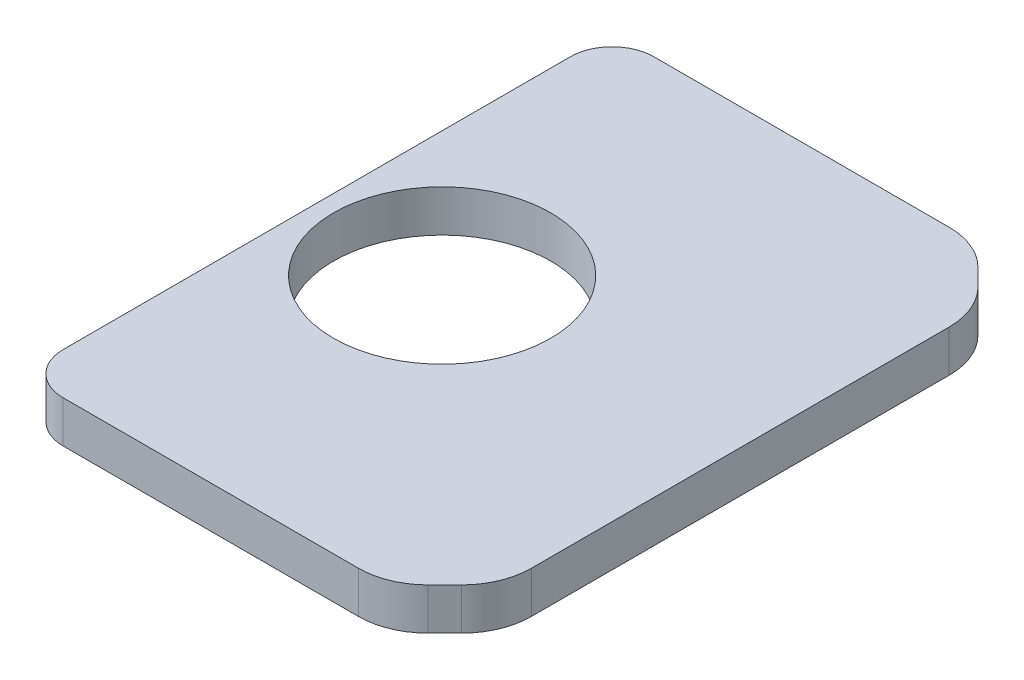
from build123d import *

# Parameters (mm, degrees)
SZKIC1_R                        = 1.65
SZKIC1_R_2                      = 7.798887489
DODANIE_WYCI_GNI_CIE1_DEPTH     = 3
ZAOKR_GLENIE1_R                 = 5
WYTNIJ_WYCI_GNI_CIE1_DEPTH      = 72.750306382
WYTNIJ_WYCI_GNI_CIE1_DEPTH_BACK = 72.750306382
SZKIC2_W                        = 22.67550991
SZKIC2_H                        = 46.936854919
ZAOKR_GLENIE5_R                 = 3
SZKIC3_R                        = 1.65
WYTNIJ_WYCI_GNI_CIE2_DEPTH      = 62.58622378
DODANIE_WYCI_GNI_CIE2_START     = -0.2
SZKIC4_R                        = 1.65
DODANIE_WYCI_GNI_CIE2_DEPTH     = 0.2


with BuildPart() as part:
    # Szkic1 → Dodanie-wyciągnięcie1 (new body)
    with BuildSketch(Plane(origin=(0, 0, 0), x_dir=(1, 0, 0), z_dir=(0, 1, 0))):
        with BuildLine():
            ThreePointArc((-57.522805166, 36.596117071), (-60.573917858, 31.893472489), (-61.642766658, 26.390589884))
            Line((-61.642766658, 26.390589884), (-61.642766658, 4.401644259))
            ThreePointArc((-61.642766658, 4.401644259), (-60.573917858, -1.101238346), (-57.522805166, -5.803882929))
            Line((-57.522805166, -5.803882929), (-23.176157761, -5.803882929))
            Line((-23.176157761, -5.803882929), (-19.042766658, -1.670491825))
            Line((-19.042766658, -1.670491825), (-19.042766658, 32.462725968))
            Line((-19.042766658, 32.462725968), (-23.176157761, 36.596117071))
            Line((-23.176157761, 36.596117071), (-57.522805166, 36.596117071))
        make_face()
        with Locations(Location((-55.942766658, -0.103882929, 0), (0, 0, 270))):
            Circle(SZKIC1_R, mode=Mode.SUBTRACT)
        with Locations(Location((-24.942766658, -0.103882929, 0), (0, 0, 270))):
            Circle(SZKIC1_R, mode=Mode.SUBTRACT)
        with Locations(Location((-55.942766658, 30.896117071, 0), (0, 0, 270))):
            Circle(SZKIC1_R, mode=Mode.SUBTRACT)
        with Locations(Location((-24.942766658, 30.896117071, 0), (0, 0, 270))):
            Circle(SZKIC1_R, mode=Mode.SUBTRACT)
        with Locations(Location((-40.442766658, 15.396117071, 0), (0, 0, 270))):
            Circle(SZKIC1_R_2, mode=Mode.SUBTRACT)
    extrude(amount=DODANIE_WYCI_GNI_CIE1_DEPTH)

    # Zaokrąglenie1
    zaokr_glenie1_edges = [part.edges().sort_by_distance(p)[0] for p in [
        (-23.176157761, 1.5, -36.596117071),
        (-19.042766658, 1.5, -32.462725968),
        (-19.042766658, 1.5, 1.670491825),
        (-23.176157761, 1.5, 5.803882929),
        (-57.522805166, 1.5, 5.803882929),
        (-57.522805166, 1.5, -36.596117071),
    ]]
    fillet(zaokr_glenie1_edges, radius=ZAOKR_GLENIE1_R)

    # Szkic2 → Wytnij-wyciągnięcie1 (cut, two sides: drawn at the far end of the back side and taken through both)
    with BuildSketch(Plane.XZ.offset(-WYTNIJ_WYCI_GNI_CIE1_DEPTH_BACK)):
        with Locations((-60.780521613, -15.396117072)):
            Rectangle(SZKIC2_W, SZKIC2_H)
    extrude(amount=WYTNIJ_WYCI_GNI_CIE1_DEPTH + WYTNIJ_WYCI_GNI_CIE1_DEPTH_BACK, mode=Mode.SUBTRACT)

    # Zaokrąglenie5
    zaokr_glenie5_edges = [part.edges().sort_by_distance(p)[0] for p in [
        (-49.442766658, 1.5, -36.596117071),
        (-49.442766658, 1.5, 5.803882929),
    ]]
    fillet(zaokr_glenie5_edges, radius=ZAOKR_GLENIE5_R)

    # Szkic3 → Wytnij-wyciągnięcie2 (cut, through all)
    with BuildSketch(Plane.XZ):
        with Locations(Location((-45.052026831, -30.896117071, 0), (0, 0, 90))):
            Circle(SZKIC3_R)
        with Locations(Location((-45.052026831, 0.103882929, 0), (0, 0, 90))):
            Circle(SZKIC3_R)
    extrude(amount=-WYTNIJ_WYCI_GNI_CIE2_DEPTH, mode=Mode.SUBTRACT)

    # Szkic4 → Dodanie-wyciągnięcie2 (add)
    with BuildSketch(Plane(origin=(0, 3, 0), x_dir=(1, 0, 0), z_dir=(0, 1, 0)).offset(DODANIE_WYCI_GNI_CIE2_START)):
        with Locations(Location((-45.052026831, 30.896117071, 0), (0, 0, 270))):
            Circle(SZKIC4_R)
        with Locations(Location((-24.942766658, 30.896117071, 0), (0, 0, 270))):
            Circle(SZKIC4_R)
        with Locations(Location((-24.942766658, -0.103882929, 0), (0, 0, 270))):
            Circle(SZKIC4_R)
        with Locations(Location((-45.052026831, -0.103882929, 0), (0, 0, 270))):
            Circle(SZKIC4_R)
    extrude(amount=DODANIE_WYCI_GNI_CIE2_DEPTH)


solid = part.part
